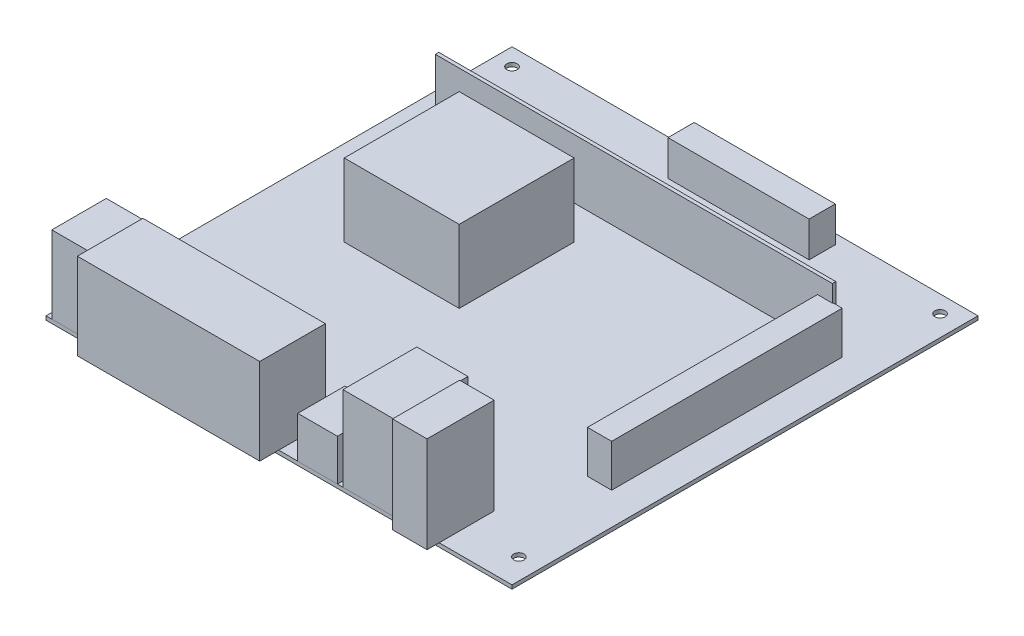
from build123d import *

# Parameters (mm, degrees)
SKETCH1_W           = 171.45
SKETCH1_H           = 171.45
PCB_DEPTH           = 1.397
SKETCH2_W           = 14.3002
SKETCH2_H           = 20.0406
PS2_DEPTH           = 28.448
SKETCH3_W           = 67.1068
SKETCH3_H           = 24.13
VGA_DEPTH           = 31.75
SKETCH4_W           = 14.605
SKETCH4_H           = 17.3482
USB_DEPTH           = 15.24
SKETCH5_W           = 18.796
SKETCH5_H           = 27.178
ETHERNETUSB_DEPTH   = 31.115
SKETCH6_W           = 12.7
SKETCH6_H           = 24.6888
AUDIO_DEPTH         = 35.3314
SKETCH7_W           = 42.291
SKETCH7_H           = 42.291
HEATSINK_DEPTH      = 26.797
SKETCH8_W           = 8.89
SKETCH8_H           = 84.836
BOSS_EXTRUDE8_DEPTH = 15.5956
SKETCH9_W           = 51.9176
SKETCH9_H           = 9.652
BOSS_EXTRUDE9_DEPTH = 13.0048
SKETCH10_R          = 1.905
HOLES_DEPTH         = 132.119134954
SKETCH11_W          = 146.05
SKETCH11_H          = 1.27
RAM_DEPTH           = 21.844


with BuildPart() as part:
    # Sketch1 → PCB (new body)
    with BuildSketch(Plane(origin=(0, 0, 0), x_dir=(1, 0, 0), z_dir=(0, 1, 0))):
        Rectangle(SKETCH1_W, SKETCH1_H)
    extrude(amount=PCB_DEPTH)

    # Sketch10 → Holes (cut, through all)
    with BuildSketch(Plane(origin=(0, 1.397, 0), x_dir=(1, 0, 0), z_dir=(0, 1, 0))):
        with Locations(Location((-79.375, 79.375, 0), (0, 0, 270))):
            Circle(SKETCH10_R)
        with Locations(Location((78.105, 79.375, 0), (0, 0, 270))):
            Circle(SKETCH10_R)
        with Locations(Location((78.105, -75.565, 0), (0, 0, 270))):
            Circle(SKETCH10_R)
        with Locations(Location((-79.375, -52.705, 0), (0, 0, 270))):
            Circle(SKETCH10_R)
    extrude(amount=-HOLES_DEPTH, mode=Mode.SUBTRACT)


with BuildPart() as body_2:
    # Sketch2 → PS2 (new body)
    with BuildSketch(Plane(origin=(0, 1.397, 0), x_dir=(1, 0, 0), z_dir=(0, 1, 0))):
        with Locations((-76.4413, -75.7047)):
            Rectangle(SKETCH2_W, SKETCH2_H)
    extrude(amount=PS2_DEPTH)


with BuildPart() as body_3:
    # Sketch3 → VGA (new body)
    with BuildSketch(Plane(origin=(0, 1.397, 0), x_dir=(1, 0, 0), z_dir=(0, 1, 0))):
        with Locations((-33.655, -80.645)):
            Rectangle(SKETCH3_W, SKETCH3_H)
    extrude(amount=VGA_DEPTH)


with BuildPart() as body_4:
    # Sketch4 → USB (new body)
    with BuildSketch(Plane(origin=(0, 1.397, 0), x_dir=(1, 0, 0), z_dir=(0, 1, 0))):
        with Locations((14.195428723, -77.0509)):
            Rectangle(SKETCH4_W, SKETCH4_H)
    extrude(amount=USB_DEPTH)


with BuildPart() as body_5:
    # Sketch5 → EthernetUSB (new body)
    with BuildSketch(Plane(origin=(0, 1.397, 0), x_dir=(1, 0, 0), z_dir=(0, 1, 0))):
        with Locations((32.927928723, -72.136)):
            Rectangle(SKETCH5_W, SKETCH5_H)
    extrude(amount=ETHERNETUSB_DEPTH)


with BuildPart() as body_6:
    # Sketch6 → Audio (new body)
    with BuildSketch(Plane(origin=(0, 1.397, 0), x_dir=(-1, 0, 0), z_dir=(0, 1, 0))):
        with Locations((-52.562128723, 77.8256)):
            Rectangle(SKETCH6_W, SKETCH6_H)
    extrude(amount=AUDIO_DEPTH)


with BuildPart() as body_7:
    # Sketch7 → Heatsink (new body)
    with BuildSketch(Plane(origin=(0, 1.397, 0), x_dir=(1, 0, 0), z_dir=(0, 1, 0))):
        with Locations((-33.2105, 13.7795)):
            Rectangle(SKETCH7_W, SKETCH7_H)
    extrude(amount=HEATSINK_DEPTH)


with BuildPart() as body_8:
    # Sketch8 → Boss-Extrude8 (new body)
    with BuildSketch(Plane(origin=(0, 1.397, 0), x_dir=(1, 0, 0), z_dir=(0, 1, 0))):
        with Locations((69.463763958, 5.164723832)):
            Rectangle(SKETCH8_W, SKETCH8_H)
    extrude(amount=BOSS_EXTRUDE8_DEPTH)


with BuildPart() as body_9:
    # Sketch9 → Boss-Extrude9 (new body)
    with BuildSketch(Plane(origin=(0, 1.397, 0), x_dir=(1, 0, 0), z_dir=(0, 1, 0))):
        with Locations((10.8712, 77.2922)):
            Rectangle(SKETCH9_W, SKETCH9_H)
    extrude(amount=BOSS_EXTRUDE9_DEPTH)


with BuildPart() as body_10:
    # Sketch11 → RAM (new body)
    with BuildSketch(Plane(origin=(0, 1.397, 0), x_dir=(1, 0, 0), z_dir=(0, 1, 0))):
        with Locations((-2.54, 48.006)):
            Rectangle(SKETCH11_W, SKETCH11_H)
    extrude(amount=RAM_DEPTH)


solid = Compound([part.part, body_2.part, body_3.part, body_4.part, body_5.part, body_6.part, body_7.part, body_8.part, body_9.part, body_10.part])
